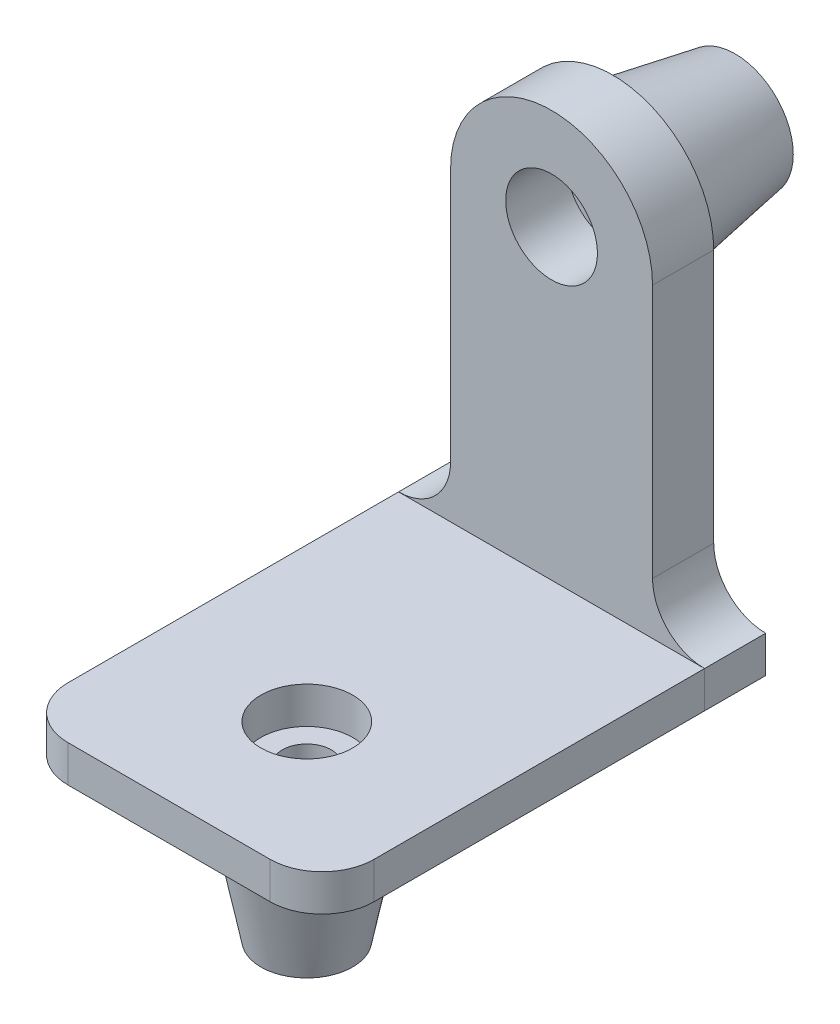
from build123d import *

# Parameters (mm, degrees)
CROQUIS1_R              = 15
SALIENTE_EXTRUIR1_DEPTH = 20
CROQUIS4_R              = 19
CROQUIS3_R              = 26
CROQUIS5_R              = 10
CORTAR_EXTRUIR1_DEPTH   = 148.610975229
CROQUIS6_W              = 100
CROQUIS6_H              = 125
CROQUIS6_R              = 15
SALIENTE_EXTRUIR2_DEPTH = 12
REDONDEO1_R             = 17
CROQUIS9_R              = 25
CROQUIS8_R              = 15
CROQUIS10_R             = 8
CORTAR_EXTRUIR2_DEPTH   = 198.863589374
CROQUIS11_W             = 100
CROQUIS11_H             = 20
SALIENTE_EXTRUIR3_DEPTH = 12


with BuildPart() as part:
    # Croquis1 → Saliente-Extruir1 (new body)
    with BuildSketch(Plane.XY):
        with BuildLine():
            Line((-50, 0), (50, 0))
            ThreePointArc((50, 0), (37.97918472, 4.97918472), (33, 17))
            Line((33, 17), (33, 100))
            ThreePointArc((33, 100), (0, 133), (-33, 100))
            Line((-33, 100), (-33, 17))
            ThreePointArc((-33, 17), (-37.97918472, 4.97918472), (-50, 0))
        make_face()
        with Locations((0, 100)):
            Circle(CROQUIS1_R, mode=Mode.SUBTRACT)
    extrude(amount=-SALIENTE_EXTRUIR1_DEPTH)

    # Croquis4 → Recubrir1 section 0
    with BuildSketch(Plane.XY.offset(-60)):
        with Locations((0, 100)):
            Circle(CROQUIS4_R)
    # Croquis3 → Recubrir1 section 1
    with BuildSketch(Plane.XY.offset(-20)):
        with Locations((0, 100)):
            Circle(CROQUIS3_R)
    loft()

    # Croquis5 → Cortar-Extruir1 (cut, through all)
    with BuildSketch(Plane.XY.offset(-20)):
        with Locations((0, 100)):
            Circle(CROQUIS5_R)
    extrude(amount=-CORTAR_EXTRUIR1_DEPTH, mode=Mode.SUBTRACT)


with BuildPart() as body_2:
    # Croquis6 → Saliente-Extruir2 (new body)
    with BuildSketch(Plane(origin=(0, 0, 0), x_dir=(1, 0, 0), z_dir=(0, 1, 0))):
        with Locations((0, -62.5)):
            Rectangle(CROQUIS6_W, CROQUIS6_H)
        with Locations(Location((0, -80, 0), (0, 0, 270))):
            Circle(CROQUIS6_R, mode=Mode.SUBTRACT)
    extrude(amount=-SALIENTE_EXTRUIR2_DEPTH)

    # Redondeo1
    redondeo1_edges = [body_2.edges().sort_by_distance(p)[0] for p in [
        (50, -6, 125),
        (-50, -6, 125),
    ]]
    fillet(redondeo1_edges, radius=REDONDEO1_R)

    # Croquis9 → Recubrir2 section 0
    with BuildSketch(Plane.XZ.offset(12)):
        with Locations((0, 80)):
            Circle(CROQUIS9_R)
    # Croquis8 → Recubrir2 section 1
    with BuildSketch(Plane(origin=(0, -62, 0), x_dir=(1, 0, 0), z_dir=(0, 1, 0))):
        with Locations((0, -80)):
            Circle(CROQUIS8_R)
    loft()

    # Croquis10 → Cortar-Extruir2 (cut, through all)
    with BuildSketch(Plane(origin=(0, -12, 0), x_dir=(1, 0, 0), z_dir=(0, 1, 0))):
        with Locations(Location((0, -80, 0), (0, 0, 270))):
            Circle(CROQUIS10_R)
    extrude(amount=-CORTAR_EXTRUIR2_DEPTH, mode=Mode.SUBTRACT)


with BuildPart() as body_3:
    # Croquis11 → Saliente-Extruir3 (new body)
    with BuildSketch(Plane.XZ):
        with Locations((0, -10)):
            Rectangle(CROQUIS11_W, CROQUIS11_H)
    extrude(amount=SALIENTE_EXTRUIR3_DEPTH)


solid = Compound([part.part, body_2.part, body_3.part])
